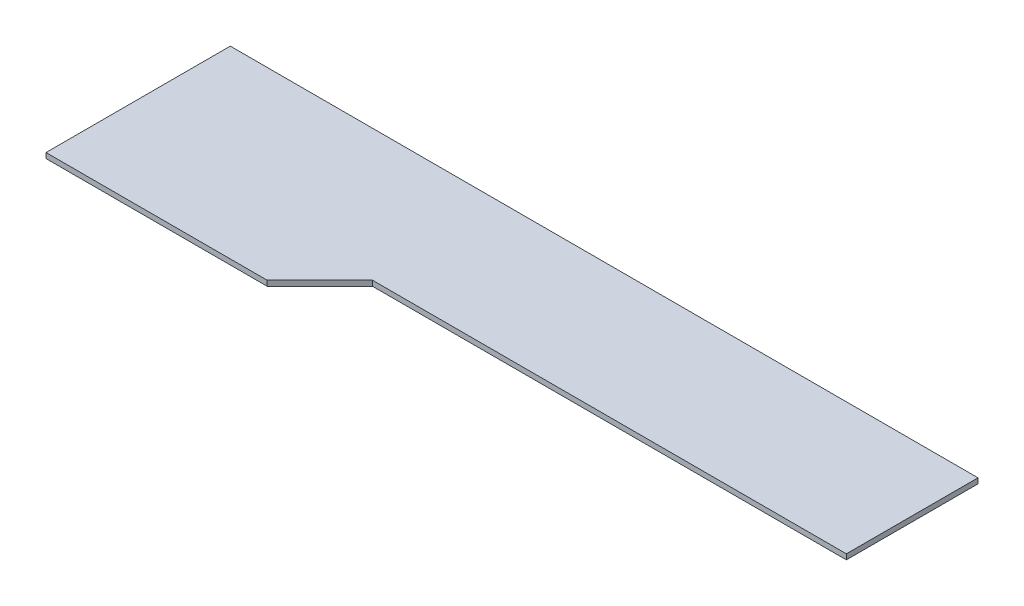
from build123d import *

# Parameters (mm, degrees)
EXTRUDE_1_DEPTH = 10


with BuildPart() as part:
    # Эскиз1 → Бобышка-Вытянуть1 (new body)
    with BuildSketch(Plane(origin=(0, 0, 0), x_dir=(1, 0, 0), z_dir=(0, 1, 0))):
        Polygon((420, -100), (520, 0), (1420, 0), (1420, 250), (0, 250), (0, 0), (0, -100), align=None)
    extrude(amount=EXTRUDE_1_DEPTH)


solid = part.part
